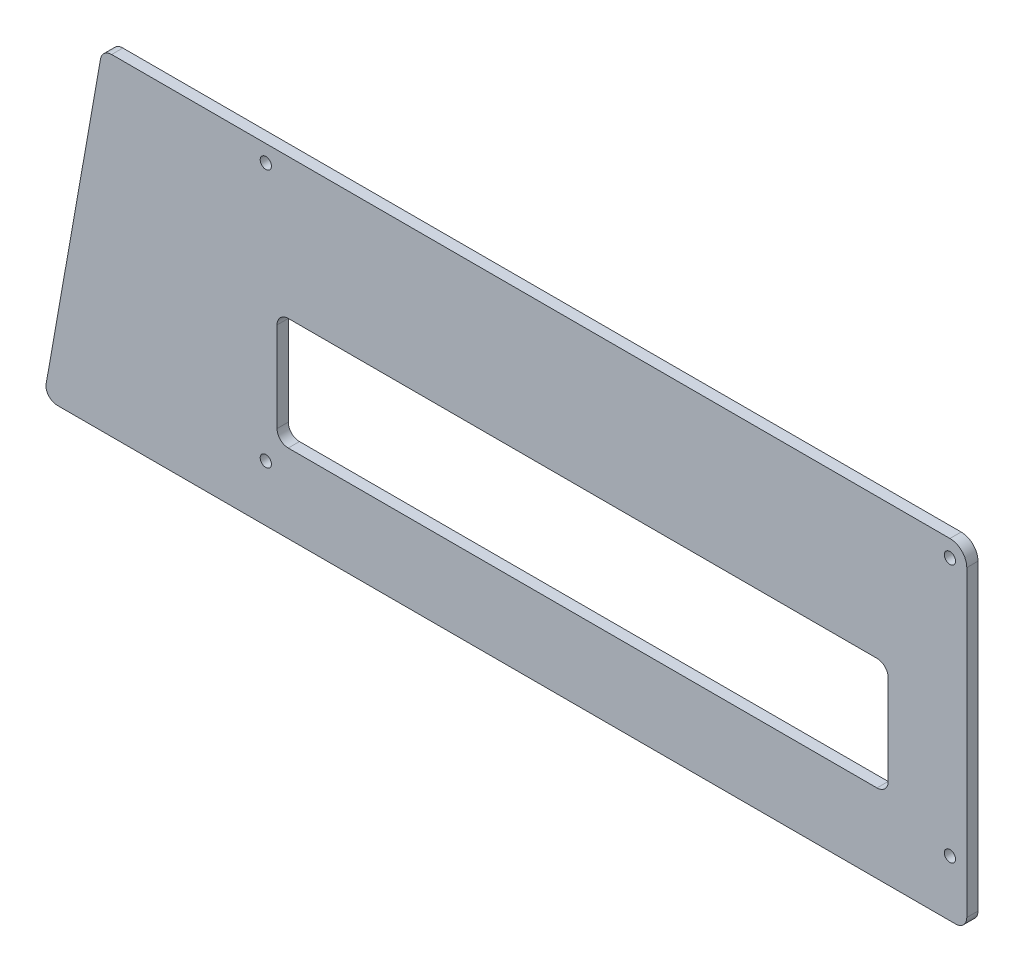
from build123d import *

# Parameters (mm, degrees)
SKETCH2_R           = 5
BOSS_EXTRUDE1_DEPTH = 10


with BuildPart() as part:
    # Sketch2 → Boss-Extrude1 (new body)
    with BuildSketch(Plane.XY):
        with BuildLine():
            Line((-737.317762878, -23.619861577), (63.164701196, -23.619861577))
            ThreePointArc((63.164701196, -23.619861577), (70.235769008, -20.690929389), (73.164701196, -13.619861577))
            Line((73.164701196, -13.619861577), (73.164701196, 256.380138423))
            ThreePointArc((73.164701196, 256.380138423), (68.771302914, 266.986740141), (58.164701196, 271.380138423))
            Line((58.164701196, 271.380138423), (-688.827843183, 271.380138423))
            ThreePointArc((-688.827843183, 271.380138423), (-695.25571928, 269.040582854), (-698.675920713, 263.116620199))
            Line((-698.675920713, 263.116620199), (-747.165840408, -11.883379801))
            ThreePointArc((-747.165840408, -11.883379801), (-744.978207309, -20.047737674), (-737.317762878, -23.619861577))
        make_face()
        with Locations(Location((58.164701196, 256.380138423, 0), (0, 0, 180))):
            Circle(SKETCH2_R, mode=Mode.SUBTRACT)
        with Locations((-551.435298804, 26.380138423)):
            Circle(SKETCH2_R, mode=Mode.SUBTRACT)
        with Locations(Location((58.164701196, 26.380138423, 0), (0, 0, 180))):
            Circle(SKETCH2_R, mode=Mode.SUBTRACT)
        with Locations((-551.435298804, 256.380138423)):
            Circle(SKETCH2_R, mode=Mode.SUBTRACT)
        with BuildLine():
            Line((-531.435298804, 46.380138423), (-6.835298804, 46.380138423))
            ThreePointArc((-6.835298804, 46.380138423), (0.235769008, 49.309070611), (3.164701196, 56.380138423))
            Line((3.164701196, 56.380138423), (3.164701196, 136.380138423))
            ThreePointArc((3.164701196, 136.380138423), (0.235769008, 143.451206235), (-6.835298804, 146.380138423))
            Line((-6.835298804, 146.380138423), (-531.435298804, 146.380138423))
            ThreePointArc((-531.435298804, 146.380138423), (-538.506366616, 143.451206235), (-541.435298804, 136.380138423))
            Line((-541.435298804, 136.380138423), (-541.435298804, 56.380138423))
            ThreePointArc((-541.435298804, 56.380138423), (-538.506366616, 49.309070611), (-531.435298804, 46.380138423))
        make_face(mode=Mode.SUBTRACT)
    extrude(amount=BOSS_EXTRUDE1_DEPTH)


solid = part.part
